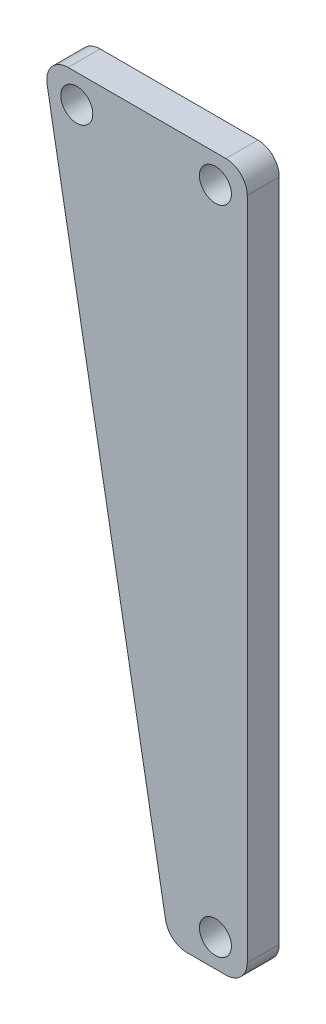
from build123d import *

# Parameters (mm, degrees)
SKETCH1_R           = 15
BOSS_EXTRUDE1_DEPTH = 30


with BuildPart() as part:
    # Sketch1 → Boss-Extrude1 (new body)
    with BuildSketch(Plane.XY):
        with BuildLine():
            Line((-194.90580249, 150.944363815), (-46.885657247, 150.944363815))
            ThreePointArc((-46.885657247, 150.944363815), (-32.743521623, 145.086499439), (-26.885657247, 130.944363815))
            Line((-26.885657247, 130.944363815), (-26.885657247, -492.119679425))
            ThreePointArc((-26.885657247, -492.119679425), (-32.743521623, -506.261815049), (-46.885657247, -512.119679425))
            Line((-46.885657247, -512.119679425), (-83.76042788, -512.119679425))
            ThreePointArc((-83.76042788, -512.119679425), (-96.600887983, -507.453386881), (-103.449613762, -495.631937859))
            Line((-103.449613762, -495.631937859), (-214.594988372, 127.432105381))
            ThreePointArc((-214.594988372, 127.432105381), (-210.239509946, 143.784823918), (-194.90580249, 150.944363815))
        make_face()
        with Locations((-186.727272727, 124.681818182)):
            Circle(SKETCH1_R, mode=Mode.SUBTRACT)
        with Locations((-56.727272727, 124.681818182)):
            Circle(SKETCH1_R, mode=Mode.SUBTRACT)
        with Locations((-56.727272727, -486.118181818)):
            Circle(SKETCH1_R, mode=Mode.SUBTRACT)
    extrude(amount=BOSS_EXTRUDE1_DEPTH)


solid = part.part
